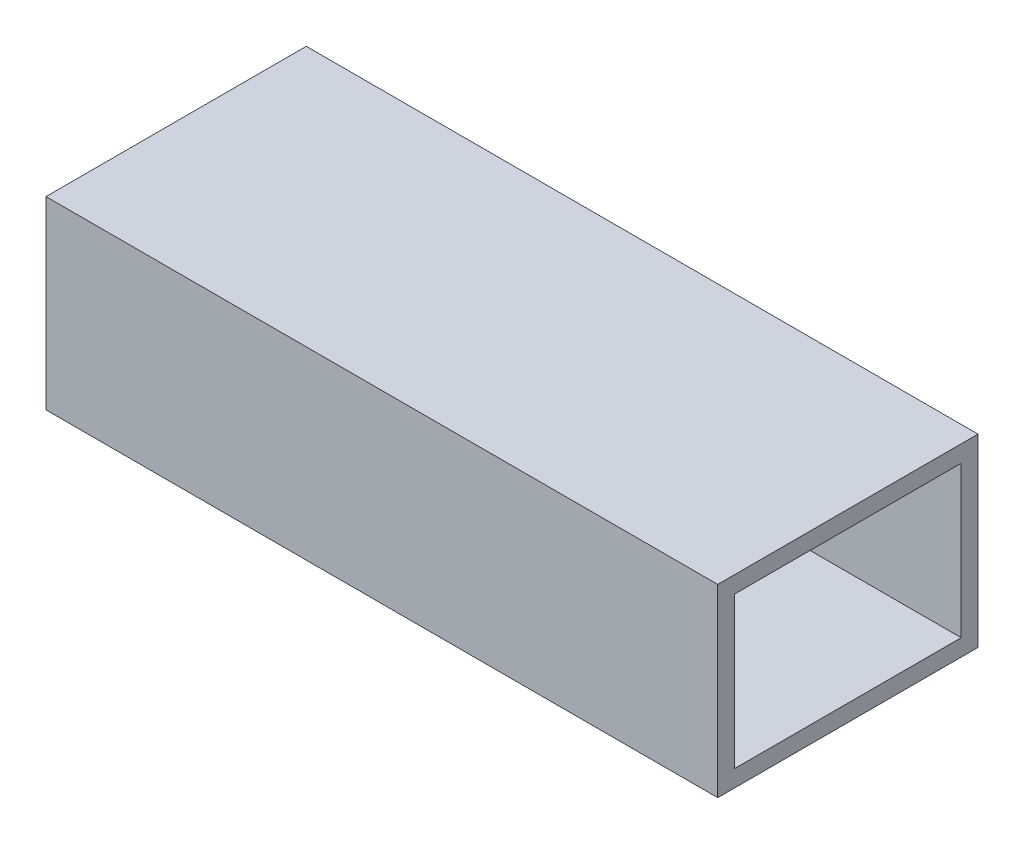
from build123d import *

# Parameters (mm, degrees)
SKETCH2_W           = 78.74
SKETCH2_H           = 55.88
SKETCH2_W_2         = 68.58
SKETCH2_H_2         = 45.72
BOSS_EXTRUDE1_DEPTH = 203.2


with BuildPart() as part:
    # Sketch2 → Boss-Extrude1 (new body)
    with BuildSketch(Plane(origin=(0, 0, 0), x_dir=(0, 0, -1), z_dir=(1, 0, 0))):
        with Locations((34.29, 22.86)):
            Rectangle(SKETCH2_W, SKETCH2_H)
        with Locations((34.29, 22.86)):
            Rectangle(SKETCH2_W_2, SKETCH2_H_2, mode=Mode.SUBTRACT)
    extrude(amount=BOSS_EXTRUDE1_DEPTH)


solid = part.part
